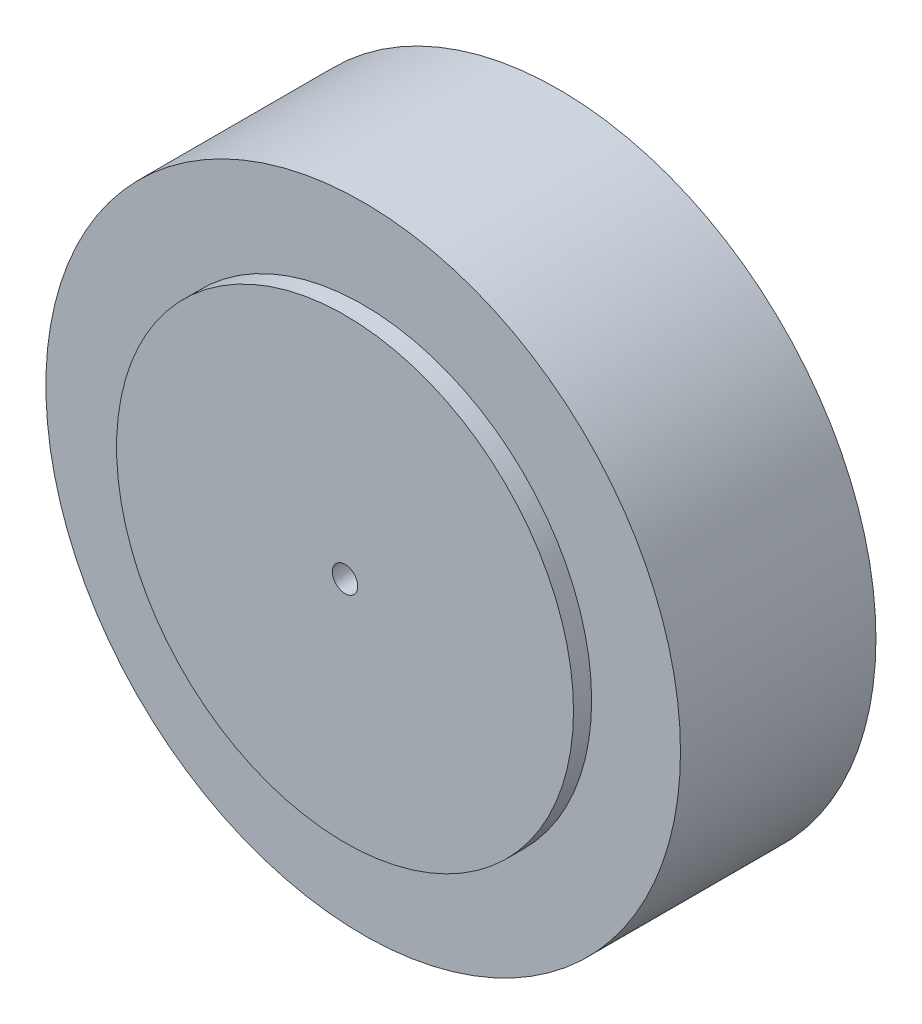
from build123d import *

# Parameters (mm, degrees)
SKETCH1_R           = 31.75
SKETCH1_R_2         = 1.27
BOSS_EXTRUDE1_DEPTH = 19.558
SKETCH2_R           = 22.86
SKETCH2_R_2         = 1.27
BOSS_EXTRUDE2_DEPTH = 1.8161


with BuildPart() as part:
    # Sketch1 → Boss-Extrude1 (new body)
    with BuildSketch(Plane.XY):
        Circle(SKETCH1_R)
        Circle(SKETCH1_R_2, mode=Mode.SUBTRACT)
    extrude(amount=BOSS_EXTRUDE1_DEPTH)

    # Sketch2 → Boss-Extrude2 (add)
    with BuildSketch(Plane.XY.offset(19.558)):
        Circle(SKETCH2_R)
        Circle(SKETCH2_R_2, mode=Mode.SUBTRACT)
    extrude(amount=BOSS_EXTRUDE2_DEPTH)


solid = part.part
